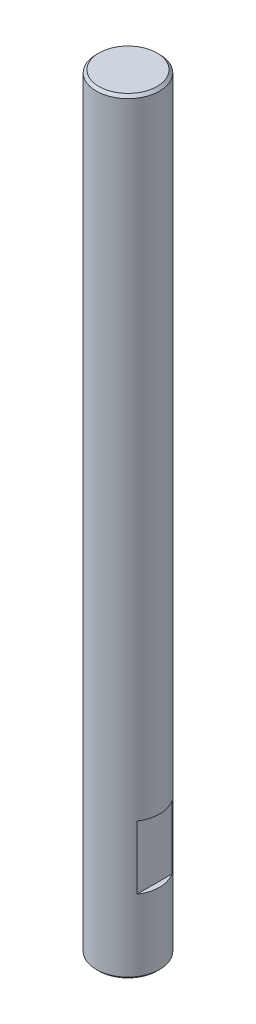
from build123d import *

# Parameters (mm, degrees)
SKETCH1_R               = 6
BOSS_EXTRUDE1_DEPTH     = 145
CHAMFER1_SIZE           = 0.5
CUT_EXTRUDE1_DEPTH      = 146.24806367
CUT_EXTRUDE1_DEPTH_BACK = 146.24806367
SKETCH2_W               = 1
SKETCH2_H               = 12


with BuildPart() as part:
    # Sketch1 → Boss-Extrude1 (new body)
    with BuildSketch(Plane(origin=(0, 0, 0), x_dir=(1, 0, 0), z_dir=(0, 1, 0))):
        with Locations(Location((0, 0, 0), (0, 0, 270))):
            Circle(SKETCH1_R)
    extrude(amount=BOSS_EXTRUDE1_DEPTH)

    # Chamfer1
    chamfer1_edges = [part.edges().sort_by_distance(p)[0] for p in [
        (0, 0, -6),
        (0, 145, -6),
    ]]
    chamfer(chamfer1_edges, length=CHAMFER1_SIZE)

    # Sketch2 → Cut-Extrude1 (cut, two sides: drawn at the far end of the back side and taken through both)
    with BuildSketch(Plane.XY.offset(-CUT_EXTRUDE1_DEPTH_BACK)):
        with Locations((5.5, 20)):
            Rectangle(SKETCH2_W, SKETCH2_H)
    extrude(amount=CUT_EXTRUDE1_DEPTH + CUT_EXTRUDE1_DEPTH_BACK, mode=Mode.SUBTRACT)


solid = part.part
